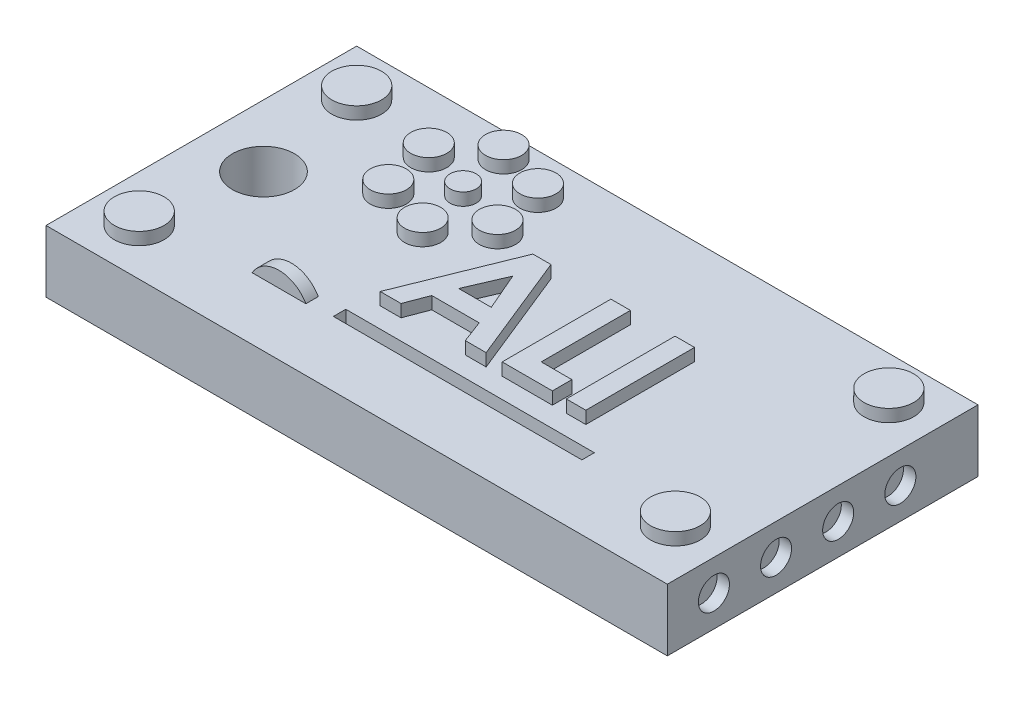
from build123d import *

# Parameters (mm, degrees)
SKETCH1_W           = 20
SKETCH1_H           = 10
SKETCH1_R           = 1
BOSS_EXTRUDE1_DEPTH = 2
SKETCH2_W           = 0.628205128
SKETCH2_H           = 3.5
BOSS_EXTRUDE2_DEPTH = 0.4
SKETCH4_W           = 8
SKETCH4_H           = 0.4
CUT_EXTRUDE4_DEPTH  = 0.4
SKETCH5_R           = 0.8
BOSS_EXTRUDE3_DEPTH = 0.4
SKETCH7_R           = 0.581669736
BOSS_EXTRUDE4_DEPTH = 0.4
SKETCH6_R           = 0.420338274
BOSS_EXTRUDE5_DEPTH = 0.4
CIRPATTERN1_COUNT   = 6
SKETCH8_R           = 0.5
CUT_EXTRUDE6_DEPTH  = 0.4
LPATTERN1_COUNT     = 4
LPATTERN1_PITCH     = 2
BOSS_EXTRUDE6_START = -2
SKETCH10_R          = 1
BOSS_EXTRUDE6_DEPTH = 0.4


with BuildPart() as part:
    # Sketch1 → Boss-Extrude1 (new body)
    with BuildSketch(Plane(origin=(0, 0, 0), x_dir=(1, 0, 0), z_dir=(0, 1, 0))):
        with Locations((10, 5)):
            Rectangle(SKETCH1_W, SKETCH1_H)
        with Locations(Location((2, 5, 0), (0, 0, 270))):
            Circle(SKETCH1_R, mode=Mode.SUBTRACT)
    extrude(amount=BOSS_EXTRUDE1_DEPTH)

    # Sketch2 → Boss-Extrude2 (add)
    # profile 1 of 3: a face of its own
    with BuildSketch(Plane(origin=(0, 2, 0), x_dir=(1, 0, 0), z_dir=(0, 1, 0))):
        Polygon((9.033403528, 6.638234894), (9.616035739, 6.638234894), (11.029497278, 3.138234894), (10.35852372, 3.138234894), (10.086488463, 3.856183612), (8.56154856, 3.856183612), (8.289513303, 3.138234894), (7.619240867, 3.138234894), align=None)
        Polygon((9.324369072, 5.69943281), (8.79992997, 4.48438874), (9.848808175, 4.48438874), align=None, mode=Mode.SUBTRACT)
    # profile 2 of 3: a face of its own
    with BuildSketch(Plane(origin=(0, 2, 0), x_dir=(1, 0, 0), z_dir=(0, 1, 0))):
        Polygon((11.545522919, 6.638234894), (12.173728047, 6.638234894), (12.173728047, 3.766440022), (13.160907534, 3.766440022), (13.160907534, 3.138234894), (11.545522919, 3.138234894), align=None)
    # profile 3 of 3: a face of its own
    with BuildSketch(Plane(origin=(0, 2, 0), x_dir=(1, 0, 0), z_dir=(0, 1, 0))):
        with Locations((13.923728047, 4.888234894)):
            Rectangle(SKETCH2_W, SKETCH2_H)
    extrude(amount=BOSS_EXTRUDE2_DEPTH)

    # Sketch4 → Cut-Extrude4 (cut)
    with BuildSketch(Plane(origin=(0, 2, 0), x_dir=(1, 0, 0), z_dir=(0, 1, 0))):
        with Locations((11.161065363, 2.289063397)):
            Rectangle(SKETCH4_W, SKETCH4_H)
    extrude(amount=-CUT_EXTRUDE4_DEPTH, mode=Mode.SUBTRACT)

    # Sketch5 → Boss-Extrude3 (add)
    with BuildSketch(Plane(origin=(0, 2, 0), x_dir=(1, 0, 0), z_dir=(0, 1, 0))):
        with Locations(Location((1.5, 8.5, 0), (0, 0, 90))):
            Circle(SKETCH5_R)
        with Locations(Location((18.5, 8.630956257, 0), (0, 0, 90))):
            Circle(SKETCH5_R)
        with Locations(Location((18.5, 1.759911555, 0), (0, 0, 90))):
            Circle(SKETCH5_R)
        with Locations(Location((1.5, 1.5, 0), (0, 0, 90))):
            Circle(SKETCH5_R)
    extrude(amount=BOSS_EXTRUDE3_DEPTH)

    # Sketch7 → Boss-Extrude4 (add)
    with BuildSketch(Plane(origin=(0, 2, 0), x_dir=(1, 0, 0), z_dir=(0, 1, 0))):
        with Locations(Location((7.145081421, 8.690538135, 0), (0, 0, 90))):
            Circle(SKETCH7_R)
    boss_extrude4 = extrude(amount=BOSS_EXTRUDE4_DEPTH)

    # Sketch6 → Boss-Extrude5 (add)
    with BuildSketch(Plane(origin=(0, 2, 0), x_dir=(1, 0, 0), z_dir=(0, 1, 0))):
        with Locations(Location((5.883797923, 7.542946747, 0), (0, 0, 90))):
            Circle(SKETCH6_R)
    extrude(amount=BOSS_EXTRUDE5_DEPTH)

    # CirPattern1: Boss-Extrude4 ×6 about axis
    cirpattern1_axis = Axis((5.883797923, 0, -7.542946747), (0, 1, 0))
    for i in range(1, CIRPATTERN1_COUNT):
        add(boss_extrude4.rotate(cirpattern1_axis, i * 360 / CIRPATTERN1_COUNT))

    # Sketch8 → Cut-Extrude6 (cut)
    with BuildSketch(Plane(origin=(20, 0, 0), x_dir=(0, 0, -1), z_dir=(1, 0, 0))):
        with Locations((1.5, 1)):
            Circle(SKETCH8_R)
    cut_extrude6 = extrude(amount=-CUT_EXTRUDE6_DEPTH, mode=Mode.SUBTRACT)

    # LPattern1: Cut-Extrude6 ×4
    with Locations(*[(0, 0, -i * LPATTERN1_PITCH) for i in range(1, LPATTERN1_COUNT)]):
        add(cut_extrude6, mode=Mode.SUBTRACT)

    # Sketch10 → Boss-Extrude6 (add)
    with BuildSketch(Plane.XY.offset(BOSS_EXTRUDE6_START)):
        with Locations((5.5, 1.5)):
            Circle(SKETCH10_R)
    extrude(amount=-BOSS_EXTRUDE6_DEPTH)


solid = part.part
